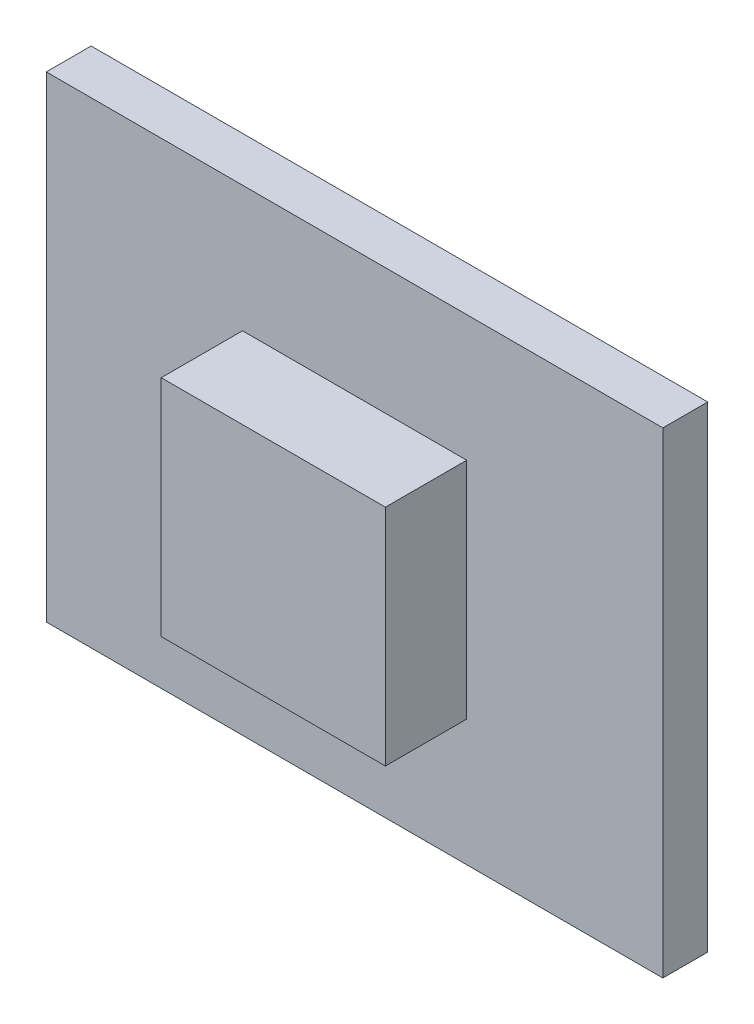
from build123d import *

# Parameters (mm, degrees)
SKETCH1_W      = 22
SKETCH1_H      = 17
PCB_DEPTH      = 1.6
SKETCH2_W      = 8
SKETCH2_H      = 8
INDUCTOR_DEPTH = 2.9


with BuildPart() as part:
    # Sketch1 → PCB (new body)
    with BuildSketch(Plane.XY):
        Rectangle(SKETCH1_W, SKETCH1_H)
    extrude(amount=PCB_DEPTH)

    # Sketch2 → Inductor (add)
    with BuildSketch(Plane.XY.offset(1.6)):
        Rectangle(SKETCH2_W, SKETCH2_H)
    extrude(amount=INDUCTOR_DEPTH)


solid = part.part
